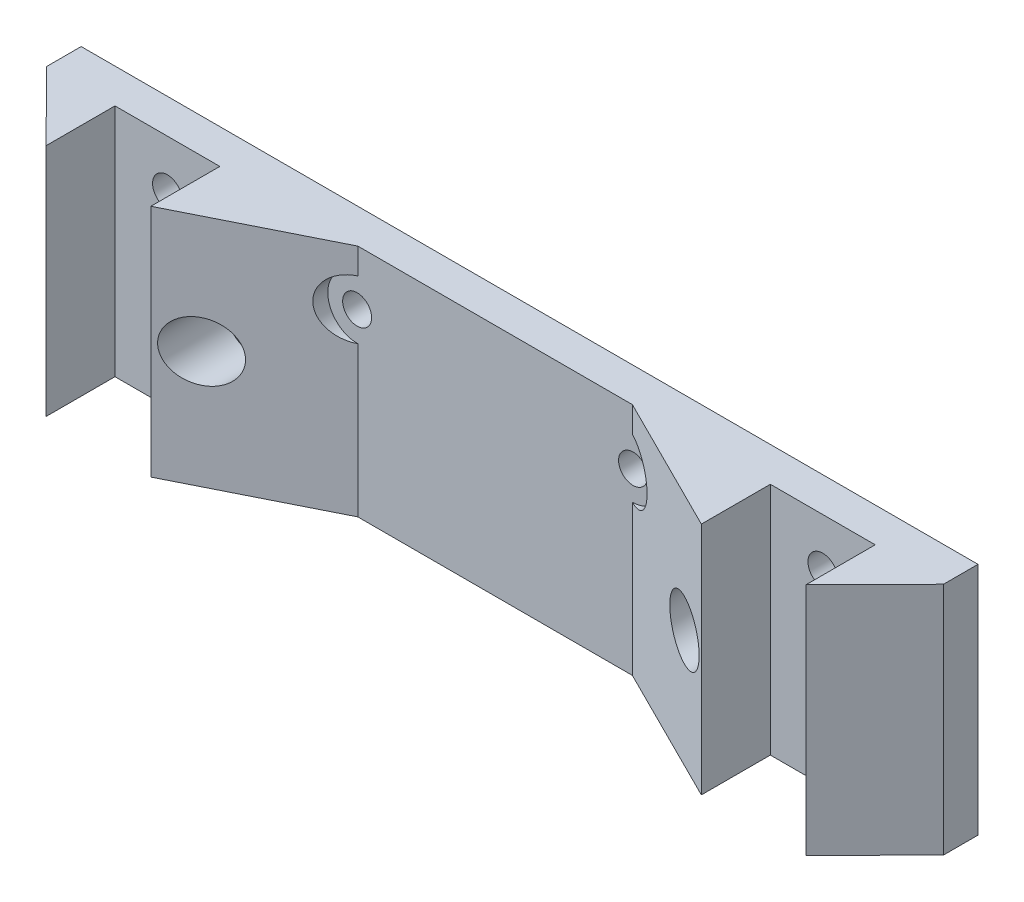
from build123d import *

# Parameters (mm, degrees)
SKETCH1_W          = 130
SKETCH1_H          = 34
SKETCH1_R          = 2.1
SKETCH1_R_2        = 2.15
EXTRUDE1_DEPTH     = 5
EXTRUDE2_DEPTH     = 34
SKETCH4_R          = 4.25
CUT_EXTRUDE1_DEPTH = 34


with BuildPart() as part:
    # Sketch1 → Extrude1 (new body)
    with BuildSketch(Plane.XY):
        with Locations((0, 93.499923245)):
            Rectangle(SKETCH1_W, SKETCH1_H)
        with Locations((35, 93.499923245)):
            Circle(SKETCH1_R, mode=Mode.SUBTRACT)
        with Locations((20, 102.499923245)):
            Circle(SKETCH1_R, mode=Mode.SUBTRACT)
        with Locations((-35, 93.499923245)):
            Circle(SKETCH1_R, mode=Mode.SUBTRACT)
        with Locations((-20, 102.499923245)):
            Circle(SKETCH1_R, mode=Mode.SUBTRACT)
        with Locations((-47.5, 103.499923245)):
            Circle(SKETCH1_R_2, mode=Mode.SUBTRACT)
        with Locations((-47.5, 83.499923245)):
            Circle(SKETCH1_R_2, mode=Mode.SUBTRACT)
        with Locations(Location((47.5, 83.499923245, 0), (0, 0, 180))):
            Circle(SKETCH1_R_2, mode=Mode.SUBTRACT)
        with Locations(Location((47.5, 103.499923245, 0), (0, 0, 180))):
            Circle(SKETCH1_R_2, mode=Mode.SUBTRACT)
    extrude(amount=EXTRUDE1_DEPTH)

    # Sketch3 → Extrude2 (add)
    with BuildSketch(Plane.XZ.offset(-76.499923245)):
        Polygon((-65, 5), (-55.1, 5), (-55.1, 15), align=None)
        Polygon((-39.9, 5), (-19.9, 5), (-39.9, 15), align=None)
        Polygon((39.9, 15), (19.9, 5), (39.9, 5), align=None)
        Polygon((65, 5), (55.1, 15), (55.1, 5), align=None)
    extrude(amount=-EXTRUDE2_DEPTH)

    # Sketch4 → Cut-Extrude1 (cut)
    with BuildSketch(Plane.XY.offset(5)):
        with Locations((-20, 102.499923245)):
            Circle(SKETCH4_R)
        with Locations((19.9, 102.499923245)):
            Circle(SKETCH4_R)
        with Locations((-35, 93.499923245)):
            Circle(SKETCH4_R)
        with Locations(Location((35, 93.499923245, 0), (0, 0, 180))):
            Circle(SKETCH4_R)
    extrude(amount=CUT_EXTRUDE1_DEPTH, mode=Mode.SUBTRACT)


solid = part.part
